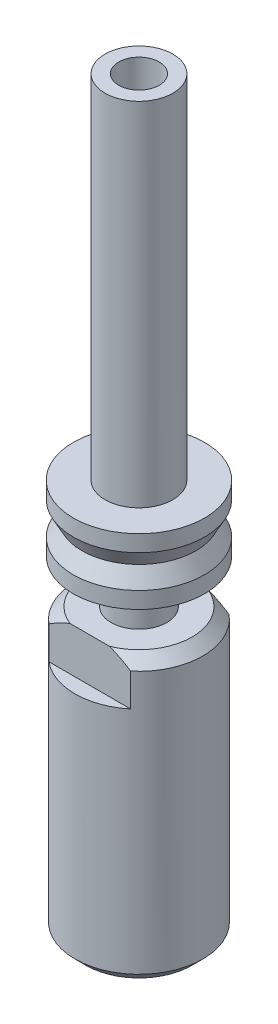
from build123d import *

# Parameters (mm, degrees)
CHAMFER1_SIZE      = 0.5
SKETCH2_W          = 2
SKETCH2_H          = 2
CUT_EXTRUDE1_DEPTH = 3
SKETCH3_W          = 6
SKETCH3_H          = 5
CUT_EXTRUDE2_DEPTH = 3


with BuildPart() as part:
    # Sketch1 → Revolve1 (revolve)
    with BuildSketch(Plane(origin=(0, 0, 0), x_dir=(0, 0, -1), z_dir=(1, 0, 0)), mode=Mode.PRIVATE) as revolve1_sk:
        Polygon((0.925, 24.1), (0.925, -15), (2.925, -15), (2.925, -2), (1.275, -2), (1.275, 0), (3, 0), (3, 0.753), (2.6, 1.5), (3, 2.247), (3, 3), (1.55, 3), (1.55, 24.1), align=None)
    revolve(revolve1_sk.sketch.rotate(Axis((0, 26.094339623, 0), (0, -1, 0)), 180), axis=Axis((0, 26.094339623, 0), (0, -1, 0)))

    # Chamfer1
    chamfer1_edges = [part.edges().sort_by_distance(p)[0] for p in [
        (0, -2, -2.925),
        (0, -15, -2.925),
    ]]
    chamfer(chamfer1_edges, length=CHAMFER1_SIZE)

    # Sketch2 → Cut-Extrude1 (cut, symmetric)
    with BuildSketch(Plane(origin=(0, 0, 0), x_dir=(0, 0, -1), z_dir=(1, 0, 0))):
        with Locations((-3.25, -3)):
            Rectangle(SKETCH2_W, SKETCH2_H)
        with Locations((3.25, -3)):
            Rectangle(SKETCH2_W, SKETCH2_H)
    extrude(amount=CUT_EXTRUDE1_DEPTH, both=True, mode=Mode.SUBTRACT)

    # Sketch3 → Cut-Extrude2 (cut, symmetric)
    with BuildSketch(Plane(origin=(0, 0, 0), x_dir=(0, 0, -1), z_dir=(1, 0, 0))):
        with Locations((0, 21.6)):
            Rectangle(SKETCH3_W, SKETCH3_H)
    extrude(amount=CUT_EXTRUDE2_DEPTH, both=True, mode=Mode.SUBTRACT)


solid = part.part
